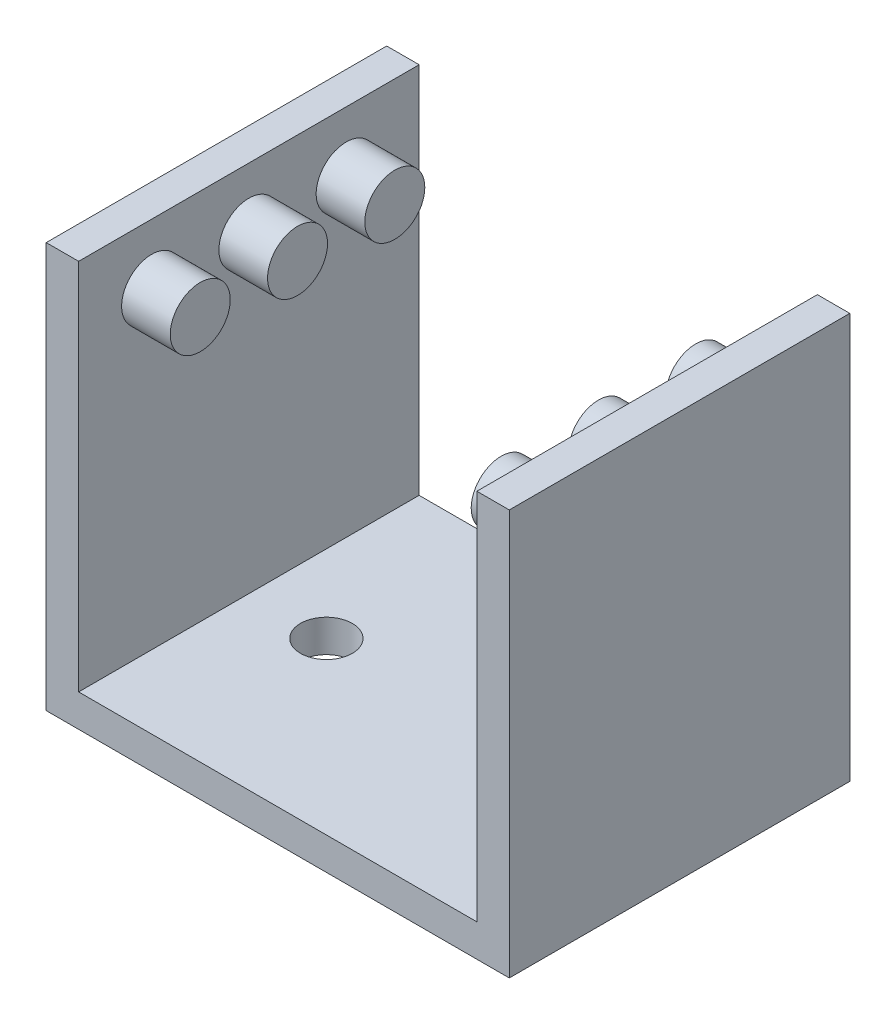
from build123d import *

# Parameters (mm, degrees)
BOSS_EXTRUDE4_DEPTH = 21
SKETCH7_R           = 1.6
CUT_EXTRUDE1_DEPTH  = 3
SKETCH5_R           = 1.85
BOSS_EXTRUDE5_DEPTH = 3
BOSS_EXTRUDE6_START = 3
SKETCH8_R           = 1.85
BOSS_EXTRUDE6_DEPTH = 3


with BuildPart() as part:
    # Sketch1 → Boss-Extrude4 (new body)
    with BuildSketch(Plane.XY):
        Polygon((12.320696932, -20.271970514), (14.320696932, -20.271970514), (14.320696932, -45.271970514), (-14.239524115, -45.271970514), (-14.239524115, -20.271970514), (-12.239524115, -20.271970514), (-12.239524115, -43.271970514), (12.320696932, -43.271970514), align=None)
    extrude(amount=-BOSS_EXTRUDE4_DEPTH)

    # Sketch7 → Cut-Extrude1 (cut)
    with BuildSketch(Plane.XZ.offset(45.271970514)):
        with Locations(Location((-7.459347, -10.5, 0), (0, 0, 270))):
            Circle(SKETCH7_R)
        with Locations(Location((7.540540263, -10.441844196, 0), (0, 0, 90))):
            Circle(SKETCH7_R)
    extrude(amount=-CUT_EXTRUDE1_DEPTH, mode=Mode.SUBTRACT)

    # Sketch5 → Boss-Extrude5 (add)
    with BuildSketch(Plane(origin=(-12.239524115, 0, 0), x_dir=(0, 0, -1), z_dir=(1, 0, 0))):
        with Locations((16.5, -24)):
            Circle(SKETCH5_R)
        with Locations((10.5, -24)):
            Circle(SKETCH5_R)
        with Locations((4.5, -24)):
            Circle(SKETCH5_R)
    extrude(amount=BOSS_EXTRUDE5_DEPTH)

    # Sketch8 → Boss-Extrude6 (add)
    with BuildSketch(Plane.ZY.offset(-12.320696932).offset(BOSS_EXTRUDE6_START)):
        with Locations(Location((-16.5, -24, 0), (0, 0, 180))):
            Circle(SKETCH8_R)
        with Locations(Location((-10.5, -24, 0), (0, 0, 180))):
            Circle(SKETCH8_R)
        with Locations(Location((-4.5, -24, 0), (0, 0, 180))):
            Circle(SKETCH8_R)
    extrude(amount=-BOSS_EXTRUDE6_DEPTH)


solid = part.part
